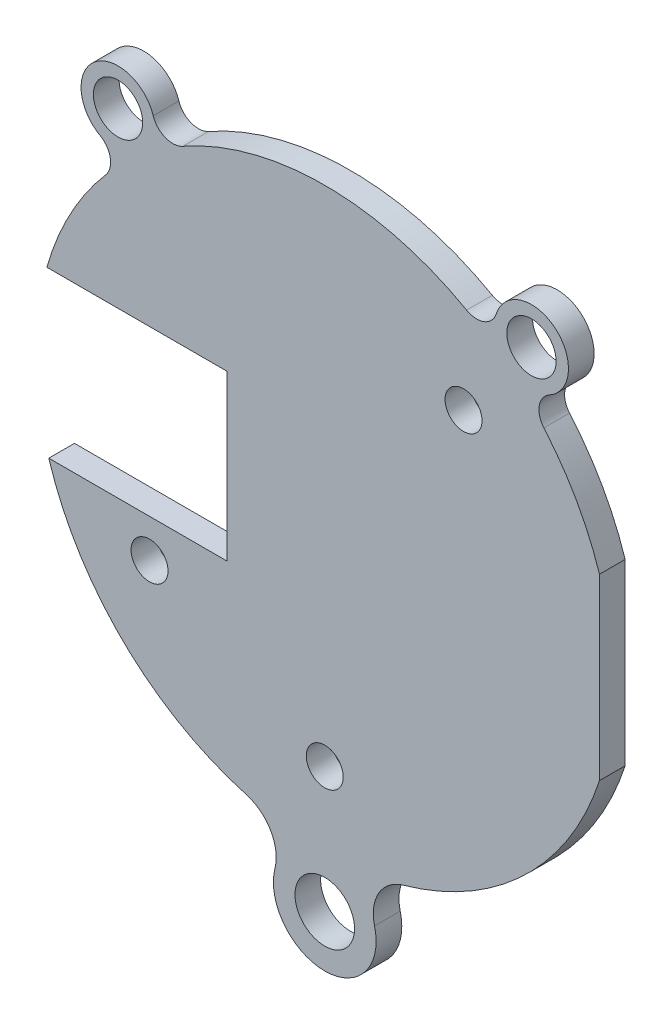
from build123d import *

# Parameters (mm, degrees)
SKETCH1_R           = 1.8415
SKETCH1_R_2         = 1.524
BOSS_EXTRUDE1_DEPTH = 1.5875
SKETCH2_R           = 1.143
CUT_EXTRUDE1_DEPTH  = 30.729408631


with BuildPart() as part:
    # Sketch1 → Boss-Extrude1 (new body)
    with BuildSketch(Plane.XY):
        with BuildLine():
            Line((-6.056265338, 4.8768), (-17.181244816, 4.8768))
            ThreePointArc((-17.181244816, 4.8768), (-15.73141865, 8.455815687), (-13.546192494, 11.63954555))
            ThreePointArc((-13.546192494, 11.63954555), (-13.259158261, 12.690113591), (-13.891550513, 13.576771304))
            ThreePointArc((-13.891550513, 13.576771304), (-14.229434947, 17.341171737), (-10.60343846, 16.274857526))
            ThreePointArc((-10.60343846, 16.274857526), (-9.857305878, 15.481530337), (-8.770915553, 15.557936625))
            ThreePointArc((-8.770915553, 15.557936625), (0, 17.859965052), (8.770915553, 15.557936625))
            ThreePointArc((8.770915553, 15.557936625), (9.857305878, 15.481530337), (10.60343846, 16.274857526))
            ThreePointArc((10.60343846, 16.274857526), (14.229434947, 17.341171737), (13.891550513, 13.576771304))
            ThreePointArc((13.891550513, 13.576771304), (13.259158261, 12.690113591), (13.546192494, 11.63954555))
            ThreePointArc((13.546192494, 11.63954555), (15.568317368, 8.752476564), (16.984058744, 5.5245))
            Line((16.984058744, 5.5245), (16.984058744, -5.5245))
            ThreePointArc((16.984058744, -5.5245), (12.377442365, -12.875452309), (4.850582957, -17.188664772))
            ThreePointArc((4.850582957, -17.188664772), (3.34119056, -18.362373067), (3.078011585, -20.256203417))
            ThreePointArc((3.078011585, -20.256203417), (0, -24.209965052), (-3.078011585, -20.256203417))
            ThreePointArc((-3.078011585, -20.256203417), (-3.34119056, -18.362373067), (-4.850582957, -17.188664772))
            ThreePointArc((-4.850582957, -17.188664772), (-12.468387001, -12.78740307), (-17.060660873, -5.2832))
            Line((-17.060660873, -5.2832), (-6.056265338, -5.2832))
            Line((-6.056265338, -5.2832), (-6.056265338, 4.8768))
        make_face()
        with Locations((0, -21.034965052)):
            Circle(SKETCH1_R, mode=Mode.SUBTRACT)
        with Locations((12.779339593, 15.573965052)):
            Circle(SKETCH1_R_2, mode=Mode.SUBTRACT)
        with Locations((-12.779339593, 15.573965052)):
            Circle(SKETCH1_R_2, mode=Mode.SUBTRACT)
    extrude(amount=BOSS_EXTRUDE1_DEPTH)

    # Sketch2 → Cut-Extrude1 (cut, through all)
    with BuildSketch(Plane.XY.offset(1.5875)):
        with Locations((8.579035657, 10.1092)):
            Circle(SKETCH2_R)
        with Locations((-10.832526773, -7.6454)):
            Circle(SKETCH2_R)
        with Locations((0, -13.2588)):
            Circle(SKETCH2_R)
    extrude(amount=-CUT_EXTRUDE1_DEPTH, mode=Mode.SUBTRACT)


solid = part.part
